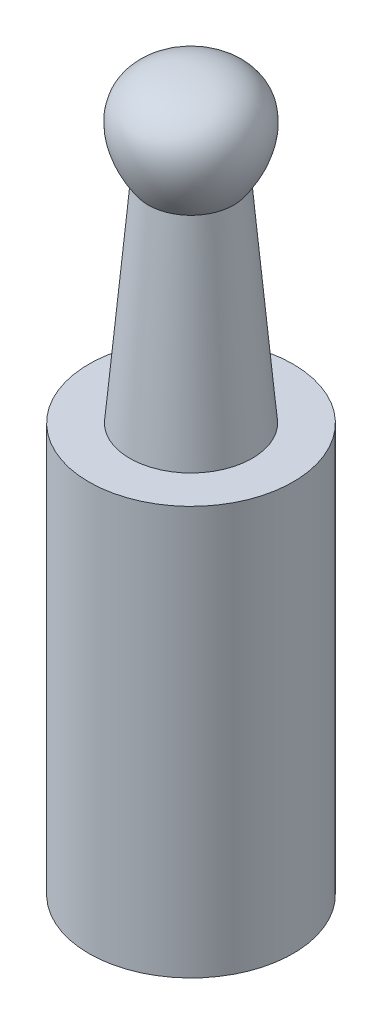
from build123d import *

# Parameters (mm, degrees)
SKETCH1_R           = 0.635
BOSS_EXTRUDE1_DEPTH = 2.54


with BuildPart() as part:
    # Sketch1 → Boss-Extrude1 (new body)
    with BuildSketch(Plane(origin=(0, 0, 0), x_dir=(1, 0, 0), z_dir=(0, 1, 0))):
        with Locations(Location((0, 0, 0), (0, 0, 270))):
            Circle(SKETCH1_R)
    extrude(amount=BOSS_EXTRUDE1_DEPTH)

    # Sketch3 → Revolve1 (revolve)
    with BuildSketch(Plane(origin=(0, 0, 0), x_dir=(0, 0, -1), z_dir=(1, 0, 0)), mode=Mode.PRIVATE) as revolve1_sk:
        with BuildLine():
            Line((-0.381, 2.54), (-0.266654632, 3.846973537))
            add(Edge.make_bspline(
                [(-0.266654632, 3.846973537), (-0.32885801, 3.931610165), (-0.461201265, 4.244591351), (-0.280999383, 4.445), (0, 4.445)],
                knots=[0, 0, 0, 0, 0.3117733, 1, 1, 1, 1], degree=3))
            Line((0, 4.445), (0, 2.54))
            Line((0, 2.54), (-0.381, 2.54))
        make_face()
    revolve(revolve1_sk.sketch.rotate(Axis((0, 2.54, 0), (0, 1, 0)), 180), axis=Axis((0, 2.54, 0), (0, 1, 0)))


solid = part.part
